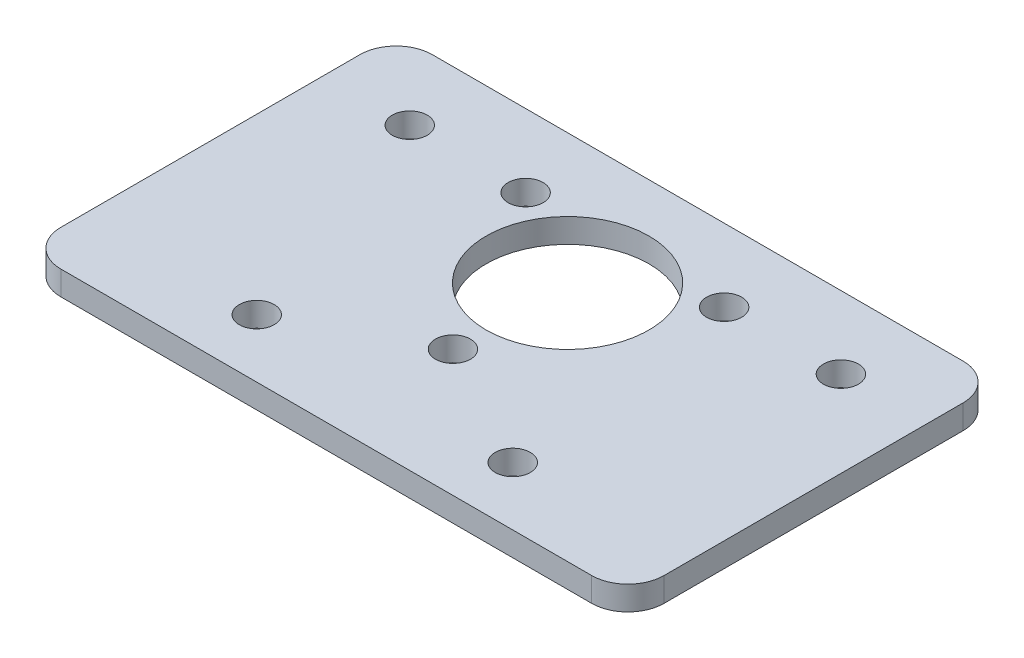
from build123d import *

# Parameters (mm, degrees)
SKETCH_2_W      = 50
SKETCH_2_H      = 30.788152334
SKETCH_2_R      = 6.75
SKETCH_2_R_2    = 1.45
EXTRUDE_1_DEPTH = 2
FILLET_2_R      = 3


with BuildPart() as part:
    # 草图2 → 凸台-拉伸1 (new body)
    with BuildSketch(Plane(origin=(0, 0, 0), x_dir=(1, 0, 0), z_dir=(0, 1, 0))):
        with Locations((0, -4.605923833)):
            Rectangle(SKETCH_2_W, SKETCH_2_H)
        with Locations(Location((0, 0, 0), (0, 0, 270))):
            Circle(SKETCH_2_R, mode=Mode.SUBTRACT)
        with Locations(Location((-8.227241336, 4.75, 0), (0, 0, 270))):
            Circle(SKETCH_2_R_2, mode=Mode.SUBTRACT)
        with Locations(Location((0, -9.5, 0), (0, 0, 270))):
            Circle(SKETCH_2_R_2, mode=Mode.SUBTRACT)
        with Locations(Location((8.227241336, 4.75, 0), (0, 0, 90))):
            Circle(SKETCH_2_R_2, mode=Mode.SUBTRACT)
        with Locations(Location((-10.611164072, -15.154312819, 0), (0, 0, 270))):
            Circle(SKETCH_2_R_2, mode=Mode.SUBTRACT)
        with Locations(Location((-17.869627786, 4.788152334, 0), (0, 0, 270))):
            Circle(SKETCH_2_R_2, mode=Mode.SUBTRACT)
        with Locations(Location((10.611164072, -15.154312819, 0), (0, 0, 90))):
            Circle(SKETCH_2_R_2, mode=Mode.SUBTRACT)
        with Locations(Location((17.869627786, 4.788152334, 0), (0, 0, 90))):
            Circle(SKETCH_2_R_2, mode=Mode.SUBTRACT)
    extrude(amount=EXTRUDE_1_DEPTH)

    # 圆角2
    fillet_2_edges = [part.edges().sort_by_distance(p)[0] for p in [
        (25, 1, 20),
        (-25, 1, 20),
        (-25, 1, -10.788152334),
        (25, 1, -10.788152334),
    ]]
    fillet(fillet_2_edges, radius=FILLET_2_R)


solid = part.part
